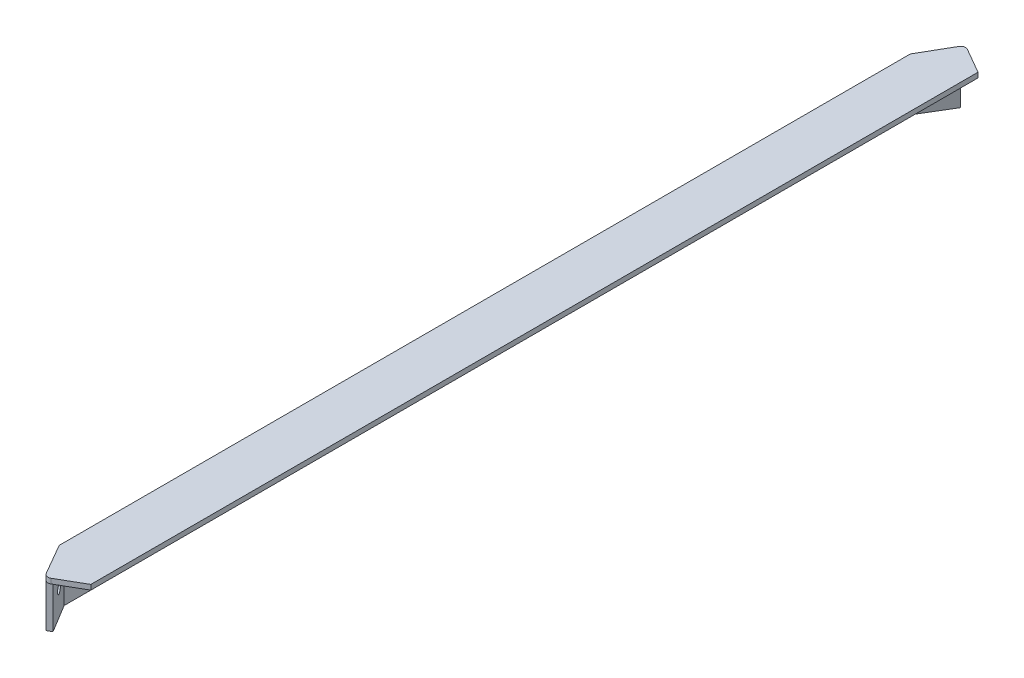
from build123d import *

# Parameters (mm, degrees)
BOSS_EXTRUDE1_DEPTH = 600
BOSS_EXTRUDE2_DEPTH = 63
BOSS_EXTRUDE4_DEPTH = 7
SKETCH10_R          = 6
CUT_EXTRUDE3_DEPTH  = 7
FILLET5_R           = 5


with BuildPart() as part:
    # Sketch1 → Boss-Extrude1 (new body)
    with BuildSketch(Plane.XY):
        Polygon((0, 0), (0, 70), (70, 70), (70, 63), (7, 63), (7, 0), align=None)
    extrude(amount=BOSS_EXTRUDE1_DEPTH)

    # Sketch2 → Boss-Extrude2 (add)
    with BuildSketch(Plane(origin=(0, 0, 0), x_dir=(1, 0, 0), z_dir=(0, 1, 0))):
        Polygon((0, -600), (25, -643.301270189), (31.062177826, -639.801270189), (7, -600), align=None)
    extrude(amount=BOSS_EXTRUDE2_DEPTH)

    # Sketch9 → Boss-Extrude4 (add)
    with BuildSketch(Plane(origin=(0, 63, 0), x_dir=(1, 0, 0), z_dir=(0, 1, 0))):
        with BuildLine():
            Line((0, -600), (25, -643.301270189))
            ThreePointArc((25, -643.301270189), (29.250444511, -646.562750973), (34.562177826, -645.863448016))
            Line((34.562177826, -645.863448016), (70, -625.403411844))
            Line((70, -625.403411844), (70, -600))
            Line((70, -600), (0, -600))
        make_face()
    extrude(amount=BOSS_EXTRUDE4_DEPTH)

    # Sketch10 → Cut-Extrude3 (cut)
    with BuildSketch(Plane(origin=(-260.517992164, 0, 157.498246278), x_dir=(-0.5173609804017633, 0, -0.8557672674026079), z_dir=(0.8557672674026079, 0, -0.5173609804017633))):
        with Locations((-538.591343444, 35)):
            Circle(SKETCH10_R)
    extrude(amount=-CUT_EXTRUDE3_DEPTH, mode=Mode.SUBTRACT)

    # Fillet5
    fillet5_edges = [part.edges().sort_by_distance(p)[0] for p in [
        (7, 63, 300),
        (19.031088913, 63, 619.900635095),
    ]]
    fillet(fillet5_edges, radius=FILLET5_R)

    # Mirror6: part across plane


with BuildPart() as part_1:
    add(part.part)
    add(part.part.mirror(Plane.XY))


solid = part_1.part
